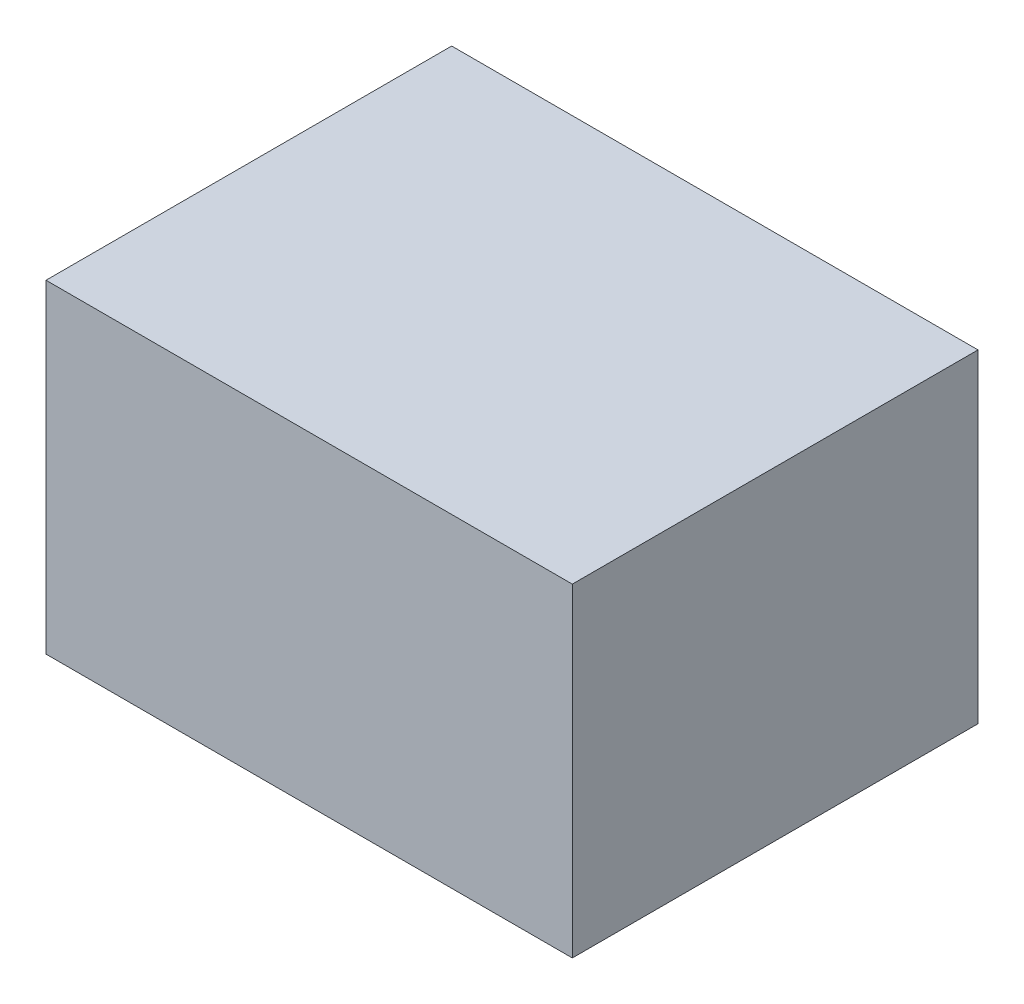
from build123d import *

# Parameters (mm, degrees)
SKETCH_1_W      = 84.527399506
SKETCH_1_H      = 65.15149131
EXTRUDE_1_DEPTH = 52


with BuildPart() as part:
    # 草图1 → 凸台-拉伸1 (new body)
    with BuildSketch(Plane(origin=(0, 0, 0), x_dir=(1, 0, 0), z_dir=(0, 1, 0))):
        Rectangle(SKETCH_1_W, SKETCH_1_H)
    extrude(amount=EXTRUDE_1_DEPTH)


solid = part.part
